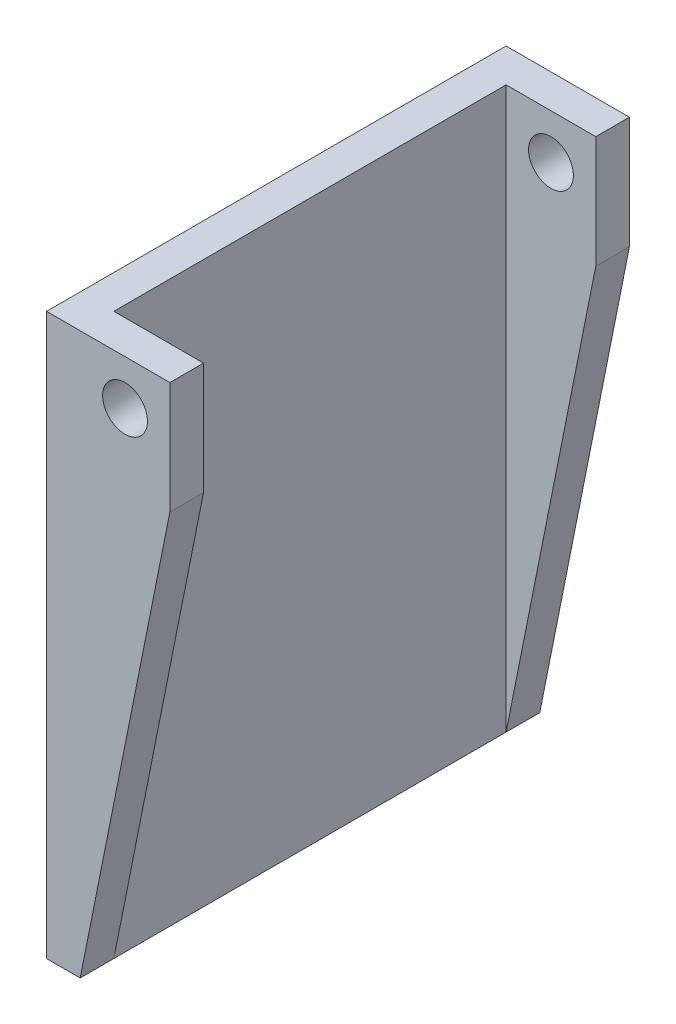
from build123d import *

# Parameters (mm, degrees)
SKETCH1_W           = 40.99099099
SKETCH1_H           = 50
BOSS_EXTRUDE1_DEPTH = 3
BOSS_EXTRUDE3_DEPTH = 3
SKETCH4_R           = 2
CUT_EXTRUDE1_DEPTH  = 3


with BuildPart() as part:
    # Sketch1 → Boss-Extrude1 (new body)
    with BuildSketch(Plane(origin=(0, 0, 0), x_dir=(0, 0, -1), z_dir=(1, 0, 0))):
        Rectangle(SKETCH1_W, SKETCH1_H)
    extrude(amount=BOSS_EXTRUDE1_DEPTH)

    # Sketch3 → Boss-Extrude3 (add)
    with BuildSketch(Plane.XY.offset(20.495495495)):
        Polygon((3, 25), (11, 25), (11, 15), (3, -25), align=None)
    boss_extrude3 = extrude(amount=-BOSS_EXTRUDE3_DEPTH)

    # Sketch4 → Cut-Extrude1 (cut)
    with BuildSketch(Plane.XY.offset(20.495495495)):
        with Locations((7, 21)):
            Circle(SKETCH4_R)
    cut_extrude1 = extrude(amount=-CUT_EXTRUDE1_DEPTH, mode=Mode.SUBTRACT)

    # Mirror1: Boss-Extrude3, Cut-Extrude1 across plane
    add(boss_extrude3.mirror(Plane.XY))
    add(cut_extrude1.mirror(Plane.XY), mode=Mode.SUBTRACT)


solid = part.part
